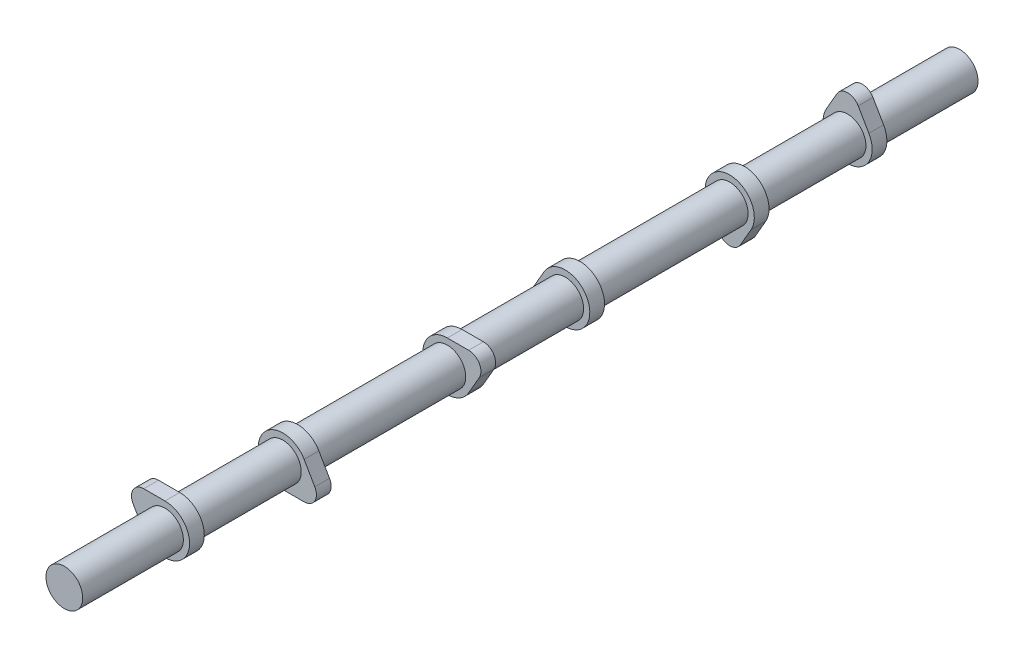
from build123d import *

# Parameters (mm, degrees)
BOSS_EXTRUDE1_DEPTH   = 7.62
BODY_MOVE_COPY3_ANGLE = 180
BOSS_EXTRUDE2_START   = -25.4
SKETCH2_R             = 9.5
BOSS_EXTRUDE2_DEPTH   = 146.05
LPATTERN1_COUNT       = 3
LPATTERN1_PITCH       = 146.05
BODY_MOVE_COPY4_ANGLE = 120
BODY_MOVE_COPY5_ANGLE = 120
BOSS_EXTRUDE3_START   = 24.94
SKETCH4_R             = 9.5
BOSS_EXTRUDE3_DEPTH   = 24.94


with BuildPart() as part:
    # Sketch1 → Boss-Extrude1 (new body)
    with BuildSketch(Plane.XY):
        with BuildLine():
            Line((-5.499261314, 15.875), (-10.998522628, 6.35))
            ThreePointArc((-10.998522628, 6.35), (0, -12.7), (10.998522628, 6.35))
            Line((10.998522628, 6.35), (5.499261314, 15.875))
            ThreePointArc((5.499261314, 15.875), (0, 19.05), (-5.499261314, 15.875))
        make_face()
    extrude(amount=BOSS_EXTRUDE1_DEPTH)


with BuildPart() as body_2:
    # Body-Move/Copy1: copy of part
    add(part.part.moved(Location((0, 0, 60.96))))


with BuildPart() as body_2_1:
    # Body-Move/Copy3: moved
    add(body_2.part.rotate(Axis((0, 0, 0), (0, 0, 1)), BODY_MOVE_COPY3_ANGLE))


with BuildPart() as part_1:
    add(part.part)

    add(body_2_1.part)  # Boss-Extrude2 merges body 2
    # Sketch2 → Boss-Extrude2 (add)
    with BuildSketch(Plane.XY.offset(BOSS_EXTRUDE2_START)):
        Circle(SKETCH2_R)
    extrude(amount=BOSS_EXTRUDE2_DEPTH)


with BuildPart() as lpattern1_1:
    # LPattern1: pattern copy
    add(part_1.part.moved(Location(Vector(0, 0, 1) * (1 * LPATTERN1_PITCH))))


with BuildPart() as lpattern1_2:
    # LPattern1: pattern copy
    add(part_1.part.moved(Location(Vector(0, 0, 1) * (2 * LPATTERN1_PITCH))))


with BuildPart() as lpattern1_1_1:
    # Body-Move/Copy4: moved
    add(lpattern1_1.part.rotate(Axis((0, 0, 0), (0, 0, 1)), BODY_MOVE_COPY4_ANGLE))


with BuildPart() as lpattern1_2_1:
    # Body-Move/Copy5: moved
    add(lpattern1_2.part.rotate(Axis((0, 0, 0), (0, 0, -1)), BODY_MOVE_COPY5_ANGLE))


with BuildPart() as part_2:
    add(part_1.part)

    # Sketch4 → Boss-Extrude3 (add)
    with BuildSketch(Plane(origin=(0, 0, -25.4), x_dir=(-1, 0, 0), z_dir=(0, 0, -1)).offset(BOSS_EXTRUDE3_START)):
        Circle(SKETCH4_R)
    extrude(amount=-BOSS_EXTRUDE3_DEPTH)


with BuildPart() as lpattern1_2_2:
    add(lpattern1_2_1.part)

    # Combine1: union LPattern1_1, part
    add(lpattern1_1_1.part)
    add(part_2.part)


solid = lpattern1_2_2.part
